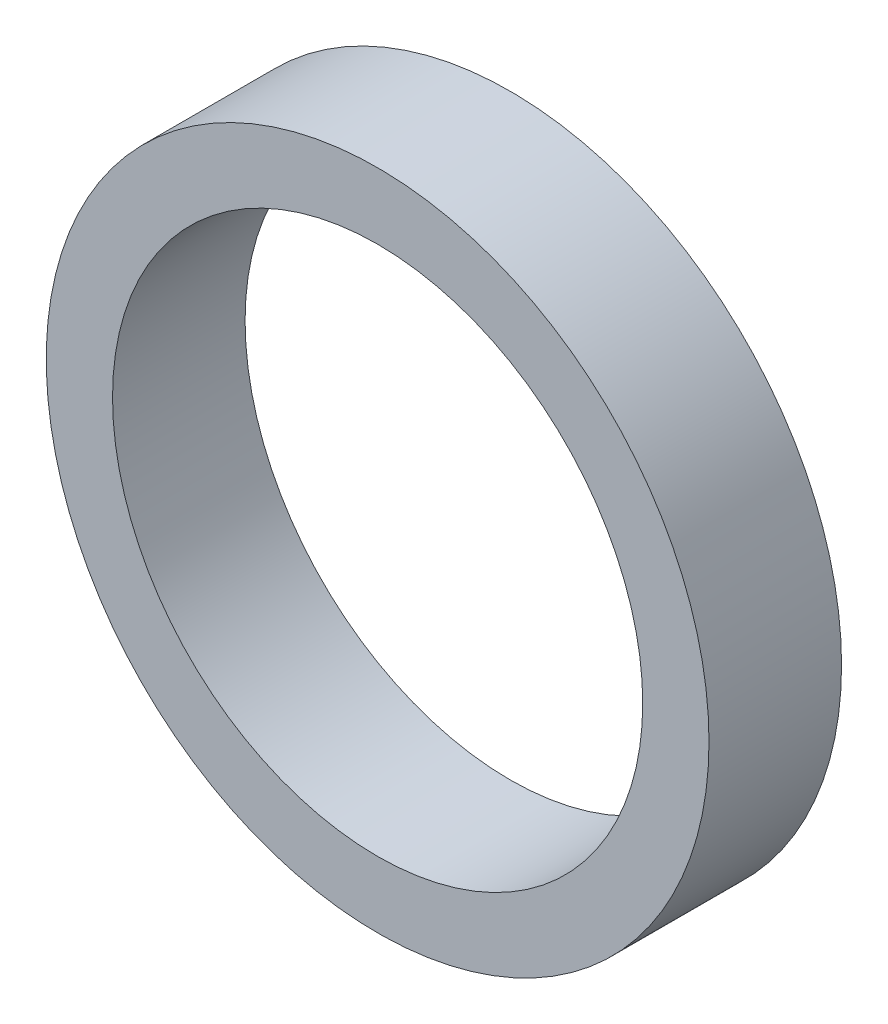
from build123d import *

# Parameters (mm, degrees)
SKETCH_1_R      = 500
SKETCH_1_R_2    = 400
EXTRUDE_1_DEPTH = 200


with BuildPart() as part:
    # 草圖1 → 填料-伸長1 (new body)
    with BuildSketch(Plane.XY):
        Circle(SKETCH_1_R)
        Circle(SKETCH_1_R_2, mode=Mode.SUBTRACT)
    extrude(amount=EXTRUDE_1_DEPTH)


solid = part.part
